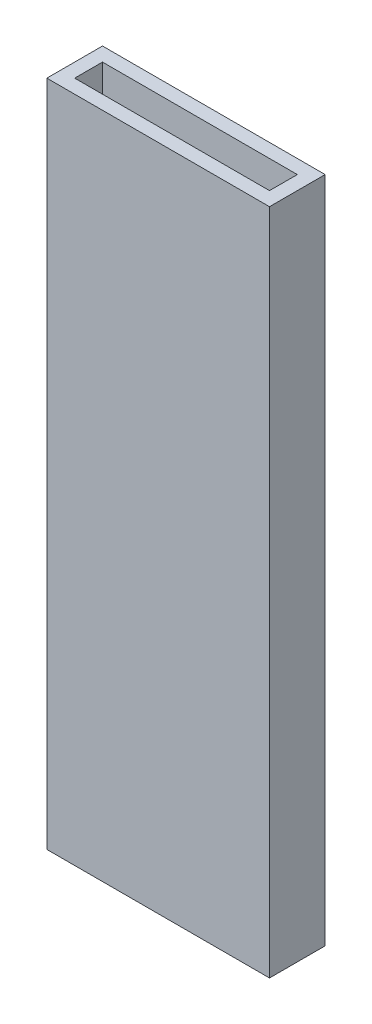
from build123d import *

# Parameters (mm, degrees)
SKETCH1_W           = 25.4
SKETCH1_H           = 6.35
BOSS_EXTRUDE1_DEPTH = 76.2
SHELL1_T            = -1.5875


with BuildPart() as part:
    # Sketch1 → Boss-Extrude1 (new body)
    with BuildSketch(Plane(origin=(0, 0, 0), x_dir=(1, 0, 0), z_dir=(0, 1, 0))):
        with Locations((12.7, 3.175)):
            Rectangle(SKETCH1_W, SKETCH1_H)
    extrude(amount=BOSS_EXTRUDE1_DEPTH)

    # Shell1
    shell1_openings = [part.faces().sort_by_distance(p)[0] for p in [
        (12.7, 76.2, -3.175),
        (12.7, 0, -3.175),
    ]]
    offset(amount=SHELL1_T, openings=shell1_openings, kind=Kind.INTERSECTION)


solid = part.part
